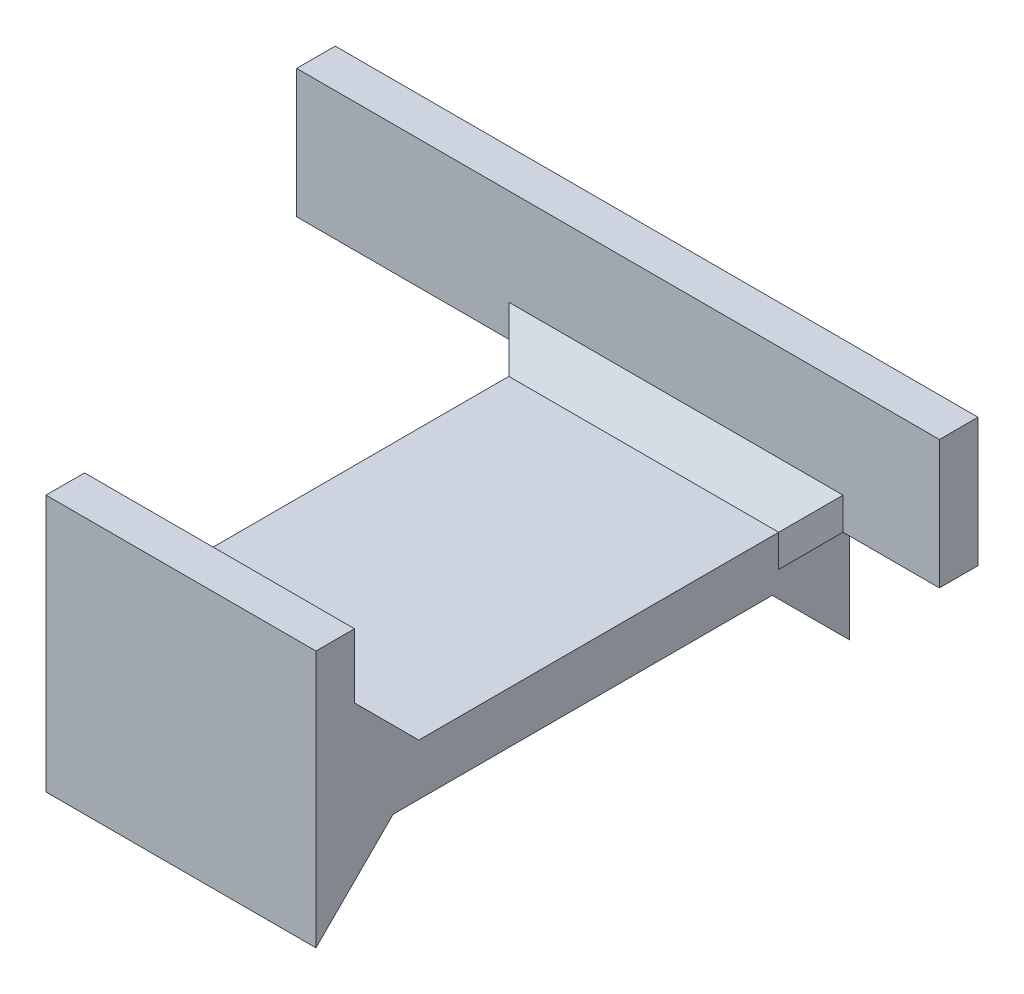
from build123d import *

# Parameters (mm, degrees)
SKETCH1_W           = 21
SKETCH1_H           = 4
BOSS_EXTRUDE1_DEPTH = 41.5
SKETCH2_W           = 21
SKETCH2_H           = 3
BOSS_EXTRUDE2_DEPTH = 10
CHAMFER1_SIZE       = 5
BOSS_EXTRUDE3_DEPTH = 21
SKETCH6_W           = 50
SKETCH6_H           = 3
BOSS_EXTRUDE4_DEPTH = 10
CHAMFER3_SIZE       = 2.5
CHAMFER4_SIZE       = 2.5
CHAMFER5_SIZE       = 2.5


with BuildPart() as part:
    # Sketch1 → Boss-Extrude1 (new body)
    with BuildSketch(Plane.XY):
        Rectangle(SKETCH1_W, SKETCH1_H)
    extrude(amount=BOSS_EXTRUDE1_DEPTH)

    # Sketch2 → Boss-Extrude2 (add)
    with BuildSketch(Plane(origin=(0, 2, 0), x_dir=(1, 0, 0), z_dir=(0, 1, 0))):
        with Locations((0, -40)):
            Rectangle(SKETCH2_W, SKETCH2_H)
    extrude(amount=BOSS_EXTRUDE2_DEPTH)

    # Chamfer1
    chamfer1_edges = [part.edges().sort_by_distance(p)[0] for p in [
        (0, 2, 38.5),
    ]]
    chamfer(chamfer1_edges, length=CHAMFER1_SIZE)

    # Sketch4 → Boss-Extrude3 (add)
    with BuildSketch(Plane(origin=(10.5, 0, 0), x_dir=(0, 0, -1), z_dir=(1, 0, 0))):
        Polygon((-35.5, -2), (-41.5, -8), (-41.5, -2), align=None)
        Polygon((0, -2), (0, -8), (-6, -2), align=None)
    extrude(amount=-BOSS_EXTRUDE3_DEPTH)

    # Sketch6 → Boss-Extrude4 (add)
    with BuildSketch(Plane(origin=(0, 2, 0), x_dir=(1, 0, 0), z_dir=(0, 1, 0))):
        with Locations((-4.5, -1.5)):
            Rectangle(SKETCH6_W, SKETCH6_H)
    extrude(amount=BOSS_EXTRUDE4_DEPTH)

    # Chamfer3
    chamfer3_edges = [part.edges().sort_by_distance(p)[0] for p in [
        (0, 2, 3),
    ]]
    chamfer(chamfer3_edges, length=CHAMFER3_SIZE)

    # Chamfer4
    chamfer4_edges = [part.edges().sort_by_distance(p)[0] for p in [
        (-10.5, 2, 1.5),
        (-10.5, 3.25, 3),
    ]]
    chamfer(chamfer4_edges, length=CHAMFER4_SIZE)

    # Chamfer5
    chamfer5_edges = [part.edges().sort_by_distance(p)[0] for p in [
        (10.5, 2, 1.5),
        (10.5, 3.25, 3),
    ]]
    chamfer(chamfer5_edges, length=CHAMFER5_SIZE)


solid = part.part
